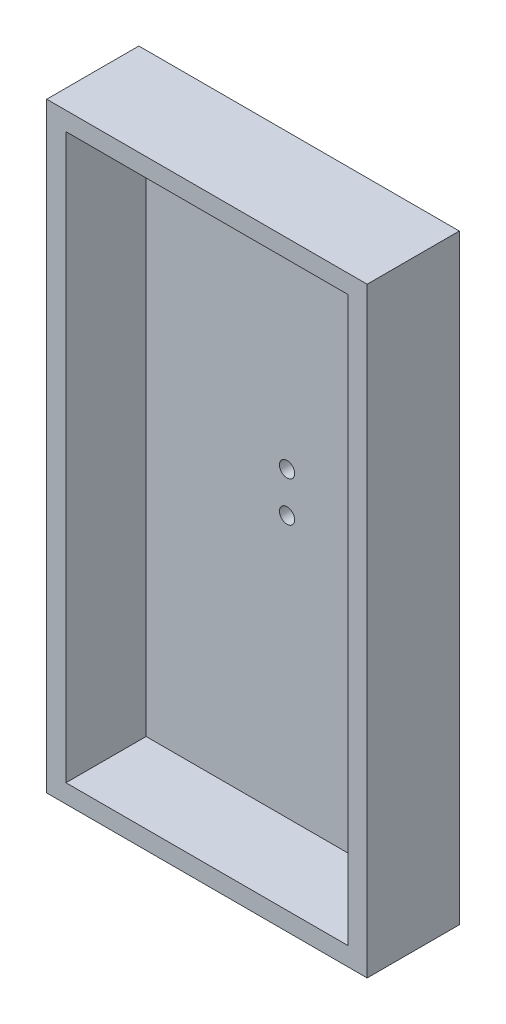
from build123d import *

# Parameters (mm, degrees)
SKETCH_1_W          = 80
SKETCH_1_H          = 150
EXTRUDE_1_DEPTH     = 3
SKETCH_2_W          = 12
SKETCH_2_H          = 22
EXTRUDE_2_DEPTH     = 5
SKETCH_3_R          = 1.9
CUT_EXTRUDE_1_DEPTH = 86.375640554
SKETCH_4_W          = 80
SKETCH_4_H          = 150
SKETCH_4_W_2        = 70.382347564
SKETCH_4_H_2        = 140.764695128
EXTRUDE_3_DEPTH     = 20


with BuildPart() as part:
    # 스케치1 → 보스-돌출1 (new body)
    with BuildSketch(Plane.XY):
        Rectangle(SKETCH_1_W, SKETCH_1_H)
    extrude(amount=EXTRUDE_1_DEPTH)

    # 스케치2 → 보스-돌출2 (add)
    with BuildSketch(Plane.XY):
        Rectangle(SKETCH_2_W, SKETCH_2_H)
    extrude(amount=-EXTRUDE_2_DEPTH)

    # 스케치3 → 컷-돌출1 (cut, through all)
    with BuildSketch(Plane(origin=(0, 0, -5), x_dir=(-1, 0, 0), z_dir=(0, 0, -1))):
        with Locations((0, 5)):
            Circle(SKETCH_3_R)
        with Locations(Location((0, -5, 0), (0, 0, 180))):
            Circle(SKETCH_3_R)
    extrude(amount=-CUT_EXTRUDE_1_DEPTH, mode=Mode.SUBTRACT)

    # 스케치4 → 보스-돌출3 (add)
    with BuildSketch(Plane.XY.offset(3)):
        Rectangle(SKETCH_4_W, SKETCH_4_H)
        Rectangle(SKETCH_4_W_2, SKETCH_4_H_2, mode=Mode.SUBTRACT)
    extrude(amount=EXTRUDE_3_DEPTH)


solid = part.part
